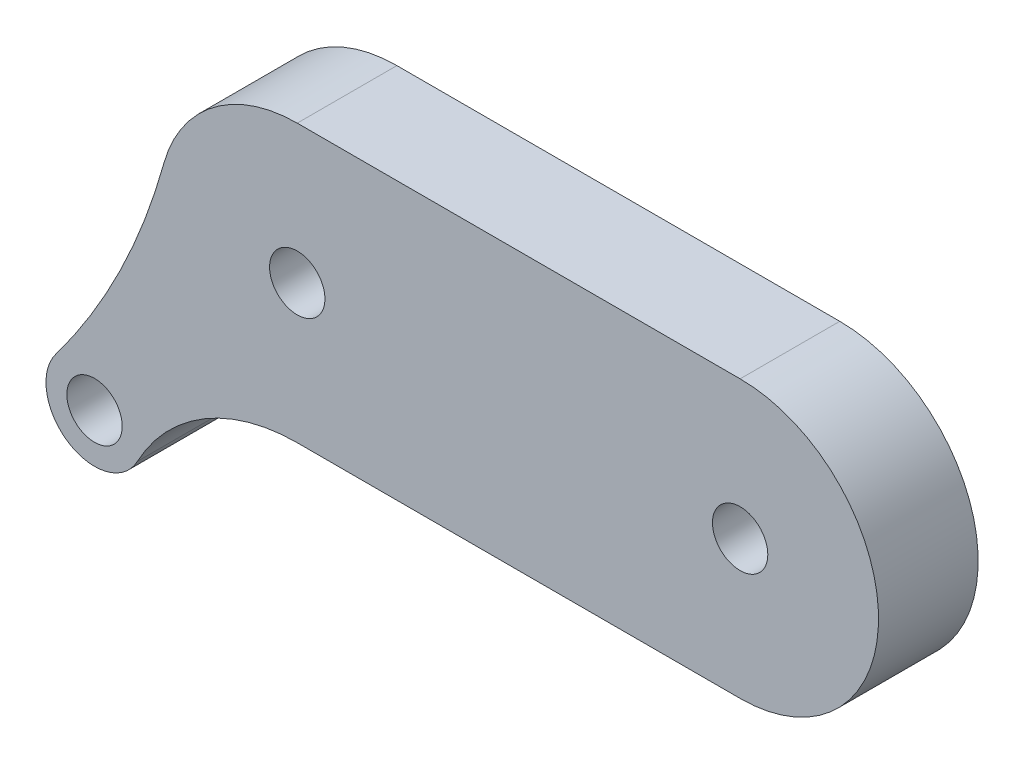
from build123d import *

# Parameters (mm, degrees)
SKETCH1_R           = 1
BOSS_EXTRUDE1_DEPTH = 3.6


with BuildPart() as part:
    # Sketch1 → Boss-Extrude1 (new body)
    with BuildSketch(Plane.XY):
        with BuildLine():
            Line((0, 5), (16, 5))
            ThreePointArc((16, 5), (21, 0), (16, -5))
            Line((16, -5), (0, -5))
            ThreePointArc((0, -5), (-3.368878467, -5.934437461), (-5.775069682, -8.470725956))
            ThreePointArc((-5.775069682, -8.470725956), (-8.265817764, -9.127128459), (-8.725078251, -6.592612716))
            ThreePointArc((-8.725078251, -6.592612716), (-6.399016419, -2.812300799), (-4.818388045, 1.335341397))
            ThreePointArc((-4.818388045, 1.335341397), (-3.026821189, 3.979742893), (0, 5))
        make_face()
        with Locations((-7.323866259, -7.647577093)):
            Circle(SKETCH1_R, mode=Mode.SUBTRACT)
        Circle(SKETCH1_R, mode=Mode.SUBTRACT)
        with Locations((16, 0)):
            Circle(SKETCH1_R, mode=Mode.SUBTRACT)
    extrude(amount=BOSS_EXTRUDE1_DEPTH)


solid = part.part
